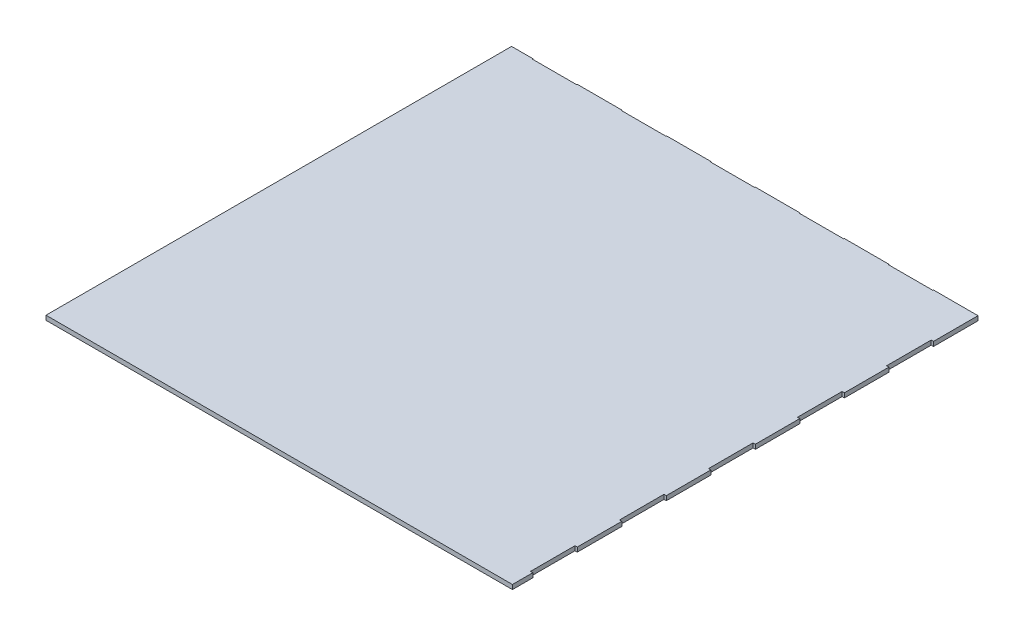
from build123d import *

# Parameters (mm, degrees)
SKETCH1_W               = 630
SKETCH1_H               = 630
BOSS_EXTRUDE1_DEPTH     = 3
SKETCH3_W               = 3
SKETCH3_H               = 30
CUT_EXTRUDE2_DEPTH      = 3
LPATTERN2_COUNT         = 10
LPATTERN2_PITCH         = 60
MIRROR1_COPY_1_SKETCH_W = 3
MIRROR1_COPY_1_SKETCH_H = 30
MIRROR1_COPY_1_DEPTH    = 3
MIRROR1_COPY_2_SKETCH_W = 3
MIRROR1_COPY_2_SKETCH_H = 30
MIRROR1_COPY_2_DEPTH    = 3
MIRROR1_COPY_3_SKETCH_W = 3
MIRROR1_COPY_3_SKETCH_H = 30
MIRROR1_COPY_3_DEPTH    = 3
MIRROR1_COPY_4_SKETCH_W = 3
MIRROR1_COPY_4_SKETCH_H = 30
MIRROR1_COPY_4_DEPTH    = 3
MIRROR1_COPY_5_SKETCH_W = 3
MIRROR1_COPY_5_SKETCH_H = 30
MIRROR1_COPY_5_DEPTH    = 3
MIRROR1_COPY_6_SKETCH_W = 3
MIRROR1_COPY_6_SKETCH_H = 30
MIRROR1_COPY_6_DEPTH    = 3
MIRROR1_COPY_7_SKETCH_W = 3
MIRROR1_COPY_7_SKETCH_H = 30
MIRROR1_COPY_7_DEPTH    = 3
MIRROR1_COPY_8_SKETCH_W = 3
MIRROR1_COPY_8_SKETCH_H = 30
MIRROR1_COPY_8_DEPTH    = 3
MIRROR1_COPY_9_SKETCH_W = 3
MIRROR1_COPY_9_SKETCH_H = 30
MIRROR1_COPY_9_DEPTH    = 3
SKETCH5_W               = 30
SKETCH5_H               = 3
CUT_EXTRUDE3_DEPTH      = 3
LPATTERN3_COUNT         = 10
LPATTERN3_PITCH         = 60
MIRROR2_COPY_1_SKETCH_W = 30
MIRROR2_COPY_1_SKETCH_H = 3
MIRROR2_COPY_1_DEPTH    = 3
MIRROR2_COPY_2_SKETCH_W = 30
MIRROR2_COPY_2_SKETCH_H = 3
MIRROR2_COPY_2_DEPTH    = 3
MIRROR2_COPY_3_SKETCH_W = 30
MIRROR2_COPY_3_SKETCH_H = 3
MIRROR2_COPY_3_DEPTH    = 3
MIRROR2_COPY_4_SKETCH_W = 30
MIRROR2_COPY_4_SKETCH_H = 3
MIRROR2_COPY_4_DEPTH    = 3
MIRROR2_COPY_5_SKETCH_W = 30
MIRROR2_COPY_5_SKETCH_H = 3
MIRROR2_COPY_5_DEPTH    = 3
MIRROR2_COPY_6_SKETCH_W = 30
MIRROR2_COPY_6_SKETCH_H = 3
MIRROR2_COPY_6_DEPTH    = 3
MIRROR2_COPY_7_SKETCH_W = 30
MIRROR2_COPY_7_SKETCH_H = 3
MIRROR2_COPY_7_DEPTH    = 3
MIRROR2_COPY_8_SKETCH_W = 30
MIRROR2_COPY_8_SKETCH_H = 3
MIRROR2_COPY_8_DEPTH    = 3
MIRROR2_COPY_9_SKETCH_W = 30
MIRROR2_COPY_9_SKETCH_H = 3
MIRROR2_COPY_9_DEPTH    = 3


with BuildPart() as part:
    # Sketch1 → Boss-Extrude1 (new body)
    with BuildSketch(Plane(origin=(0, 0, 0), x_dir=(1, 0, 0), z_dir=(0, 1, 0))):
        Rectangle(SKETCH1_W, SKETCH1_H)
    extrude(amount=BOSS_EXTRUDE1_DEPTH)

    # Sketch3 → Cut-Extrude2 (cut)
    with BuildSketch(Plane(origin=(0, 3, 0), x_dir=(1, 0, 0), z_dir=(0, 1, 0))):
        with Locations((-313.5, -270.006843512)):
            Rectangle(SKETCH3_W, SKETCH3_H)
    cut_extrude2 = extrude(amount=-CUT_EXTRUDE2_DEPTH, mode=Mode.SUBTRACT)

    # LPattern2: Cut-Extrude2 ×10
    with Locations(*[(0, 0, -i * LPATTERN2_PITCH) for i in range(1, LPATTERN2_COUNT)]):
        add(cut_extrude2, mode=Mode.SUBTRACT)

    # Mirror1: Cut-Extrude2 across plane
    add(cut_extrude2.mirror(Plane(origin=(0.72, 0, 0), x_dir=(0, 0, 1), z_dir=(1, 0, 0))), mode=Mode.SUBTRACT)

    # Mirror1 copy 1 sketch → Mirror1 copy 1 (cut)
    with BuildSketch(Plane(origin=(1.44, 3, -60), x_dir=(-1, 0, 0), z_dir=(0, 1, 0))):
        with Locations((-313.5, 270.006843512)):
            Rectangle(MIRROR1_COPY_1_SKETCH_W, MIRROR1_COPY_1_SKETCH_H)
    extrude(amount=-MIRROR1_COPY_1_DEPTH, mode=Mode.SUBTRACT)

    # Mirror1 copy 2 sketch → Mirror1 copy 2 (cut)
    with BuildSketch(Plane(origin=(1.44, 3, -120), x_dir=(-1, 0, 0), z_dir=(0, 1, 0))):
        with Locations((-313.5, 270.006843512)):
            Rectangle(MIRROR1_COPY_2_SKETCH_W, MIRROR1_COPY_2_SKETCH_H)
    extrude(amount=-MIRROR1_COPY_2_DEPTH, mode=Mode.SUBTRACT)

    # Mirror1 copy 3 sketch → Mirror1 copy 3 (cut)
    with BuildSketch(Plane(origin=(1.44, 3, -180), x_dir=(-1, 0, 0), z_dir=(0, 1, 0))):
        with Locations((-313.5, 270.006843512)):
            Rectangle(MIRROR1_COPY_3_SKETCH_W, MIRROR1_COPY_3_SKETCH_H)
    extrude(amount=-MIRROR1_COPY_3_DEPTH, mode=Mode.SUBTRACT)

    # Mirror1 copy 4 sketch → Mirror1 copy 4 (cut)
    with BuildSketch(Plane(origin=(1.44, 3, -240), x_dir=(-1, 0, 0), z_dir=(0, 1, 0))):
        with Locations((-313.5, 270.006843512)):
            Rectangle(MIRROR1_COPY_4_SKETCH_W, MIRROR1_COPY_4_SKETCH_H)
    extrude(amount=-MIRROR1_COPY_4_DEPTH, mode=Mode.SUBTRACT)

    # Mirror1 copy 5 sketch → Mirror1 copy 5 (cut)
    with BuildSketch(Plane(origin=(1.44, 3, -300), x_dir=(-1, 0, 0), z_dir=(0, 1, 0))):
        with Locations((-313.5, 270.006843512)):
            Rectangle(MIRROR1_COPY_5_SKETCH_W, MIRROR1_COPY_5_SKETCH_H)
    extrude(amount=-MIRROR1_COPY_5_DEPTH, mode=Mode.SUBTRACT)

    # Mirror1 copy 6 sketch → Mirror1 copy 6 (cut)
    with BuildSketch(Plane(origin=(1.44, 3, -360), x_dir=(-1, 0, 0), z_dir=(0, 1, 0))):
        with Locations((-313.5, 270.006843512)):
            Rectangle(MIRROR1_COPY_6_SKETCH_W, MIRROR1_COPY_6_SKETCH_H)
    extrude(amount=-MIRROR1_COPY_6_DEPTH, mode=Mode.SUBTRACT)

    # Mirror1 copy 7 sketch → Mirror1 copy 7 (cut)
    with BuildSketch(Plane(origin=(1.44, 3, -420), x_dir=(-1, 0, 0), z_dir=(0, 1, 0))):
        with Locations((-313.5, 270.006843512)):
            Rectangle(MIRROR1_COPY_7_SKETCH_W, MIRROR1_COPY_7_SKETCH_H)
    extrude(amount=-MIRROR1_COPY_7_DEPTH, mode=Mode.SUBTRACT)

    # Mirror1 copy 8 sketch → Mirror1 copy 8 (cut)
    with BuildSketch(Plane(origin=(1.44, 3, -480), x_dir=(-1, 0, 0), z_dir=(0, 1, 0))):
        with Locations((-313.5, 270.006843512)):
            Rectangle(MIRROR1_COPY_8_SKETCH_W, MIRROR1_COPY_8_SKETCH_H)
    extrude(amount=-MIRROR1_COPY_8_DEPTH, mode=Mode.SUBTRACT)

    # Mirror1 copy 9 sketch → Mirror1 copy 9 (cut)
    with BuildSketch(Plane(origin=(1.44, 3, -540), x_dir=(-1, 0, 0), z_dir=(0, 1, 0))):
        with Locations((-313.5, 270.006843512)):
            Rectangle(MIRROR1_COPY_9_SKETCH_W, MIRROR1_COPY_9_SKETCH_H)
    extrude(amount=-MIRROR1_COPY_9_DEPTH, mode=Mode.SUBTRACT)

    # Sketch5 → Cut-Extrude3 (cut)
    with BuildSketch(Plane(origin=(0, 3, 0), x_dir=(1, 0, 0), z_dir=(0, 1, 0))):
        with Locations((-270.000314512, -313.5)):
            Rectangle(SKETCH5_W, SKETCH5_H)
    cut_extrude3 = extrude(amount=-CUT_EXTRUDE3_DEPTH, mode=Mode.SUBTRACT)

    # LPattern3: Cut-Extrude3 ×10
    with Locations(*[(i * LPATTERN3_PITCH, 0, 0) for i in range(1, LPATTERN3_COUNT)]):
        add(cut_extrude3, mode=Mode.SUBTRACT)

    # Mirror2: Cut-Extrude3 across plane
    add(cut_extrude3.mirror(Plane.XY.offset(-1.29)), mode=Mode.SUBTRACT)

    # Mirror2 copy 1 sketch → Mirror2 copy 1 (cut)
    with BuildSketch(Plane(origin=(60, 3, -2.58), x_dir=(1, 0, 0), z_dir=(0, 1, 0))):
        with Locations((-270.000314512, 313.5)):
            Rectangle(MIRROR2_COPY_1_SKETCH_W, MIRROR2_COPY_1_SKETCH_H)
    extrude(amount=-MIRROR2_COPY_1_DEPTH, mode=Mode.SUBTRACT)

    # Mirror2 copy 2 sketch → Mirror2 copy 2 (cut)
    with BuildSketch(Plane(origin=(120, 3, -2.58), x_dir=(1, 0, 0), z_dir=(0, 1, 0))):
        with Locations((-270.000314512, 313.5)):
            Rectangle(MIRROR2_COPY_2_SKETCH_W, MIRROR2_COPY_2_SKETCH_H)
    extrude(amount=-MIRROR2_COPY_2_DEPTH, mode=Mode.SUBTRACT)

    # Mirror2 copy 3 sketch → Mirror2 copy 3 (cut)
    with BuildSketch(Plane(origin=(180, 3, -2.58), x_dir=(1, 0, 0), z_dir=(0, 1, 0))):
        with Locations((-270.000314512, 313.5)):
            Rectangle(MIRROR2_COPY_3_SKETCH_W, MIRROR2_COPY_3_SKETCH_H)
    extrude(amount=-MIRROR2_COPY_3_DEPTH, mode=Mode.SUBTRACT)

    # Mirror2 copy 4 sketch → Mirror2 copy 4 (cut)
    with BuildSketch(Plane(origin=(240, 3, -2.58), x_dir=(1, 0, 0), z_dir=(0, 1, 0))):
        with Locations((-270.000314512, 313.5)):
            Rectangle(MIRROR2_COPY_4_SKETCH_W, MIRROR2_COPY_4_SKETCH_H)
    extrude(amount=-MIRROR2_COPY_4_DEPTH, mode=Mode.SUBTRACT)

    # Mirror2 copy 5 sketch → Mirror2 copy 5 (cut)
    with BuildSketch(Plane(origin=(300, 3, -2.58), x_dir=(1, 0, 0), z_dir=(0, 1, 0))):
        with Locations((-270.000314512, 313.5)):
            Rectangle(MIRROR2_COPY_5_SKETCH_W, MIRROR2_COPY_5_SKETCH_H)
    extrude(amount=-MIRROR2_COPY_5_DEPTH, mode=Mode.SUBTRACT)

    # Mirror2 copy 6 sketch → Mirror2 copy 6 (cut)
    with BuildSketch(Plane(origin=(360, 3, -2.58), x_dir=(1, 0, 0), z_dir=(0, 1, 0))):
        with Locations((-270.000314512, 313.5)):
            Rectangle(MIRROR2_COPY_6_SKETCH_W, MIRROR2_COPY_6_SKETCH_H)
    extrude(amount=-MIRROR2_COPY_6_DEPTH, mode=Mode.SUBTRACT)

    # Mirror2 copy 7 sketch → Mirror2 copy 7 (cut)
    with BuildSketch(Plane(origin=(420, 3, -2.58), x_dir=(1, 0, 0), z_dir=(0, 1, 0))):
        with Locations((-270.000314512, 313.5)):
            Rectangle(MIRROR2_COPY_7_SKETCH_W, MIRROR2_COPY_7_SKETCH_H)
    extrude(amount=-MIRROR2_COPY_7_DEPTH, mode=Mode.SUBTRACT)

    # Mirror2 copy 8 sketch → Mirror2 copy 8 (cut)
    with BuildSketch(Plane(origin=(480, 3, -2.58), x_dir=(1, 0, 0), z_dir=(0, 1, 0))):
        with Locations((-270.000314512, 313.5)):
            Rectangle(MIRROR2_COPY_8_SKETCH_W, MIRROR2_COPY_8_SKETCH_H)
    extrude(amount=-MIRROR2_COPY_8_DEPTH, mode=Mode.SUBTRACT)

    # Mirror2 copy 9 sketch → Mirror2 copy 9 (cut)
    with BuildSketch(Plane(origin=(540, 3, -2.58), x_dir=(1, 0, 0), z_dir=(0, 1, 0))):
        with Locations((-270.000314512, 313.5)):
            Rectangle(MIRROR2_COPY_9_SKETCH_W, MIRROR2_COPY_9_SKETCH_H)
    extrude(amount=-MIRROR2_COPY_9_DEPTH, mode=Mode.SUBTRACT)

    # SurfaceCut1
    split(bisect_by=Plane.XY.offset(-1.29), keep=Keep.BOTTOM)

    # SurfaceCut2
    split(bisect_by=Plane(origin=(0.72, 0, 0), x_dir=(0, 0, -1), z_dir=(1, 0, 0)), keep=Keep.TOP)


solid = part.part
